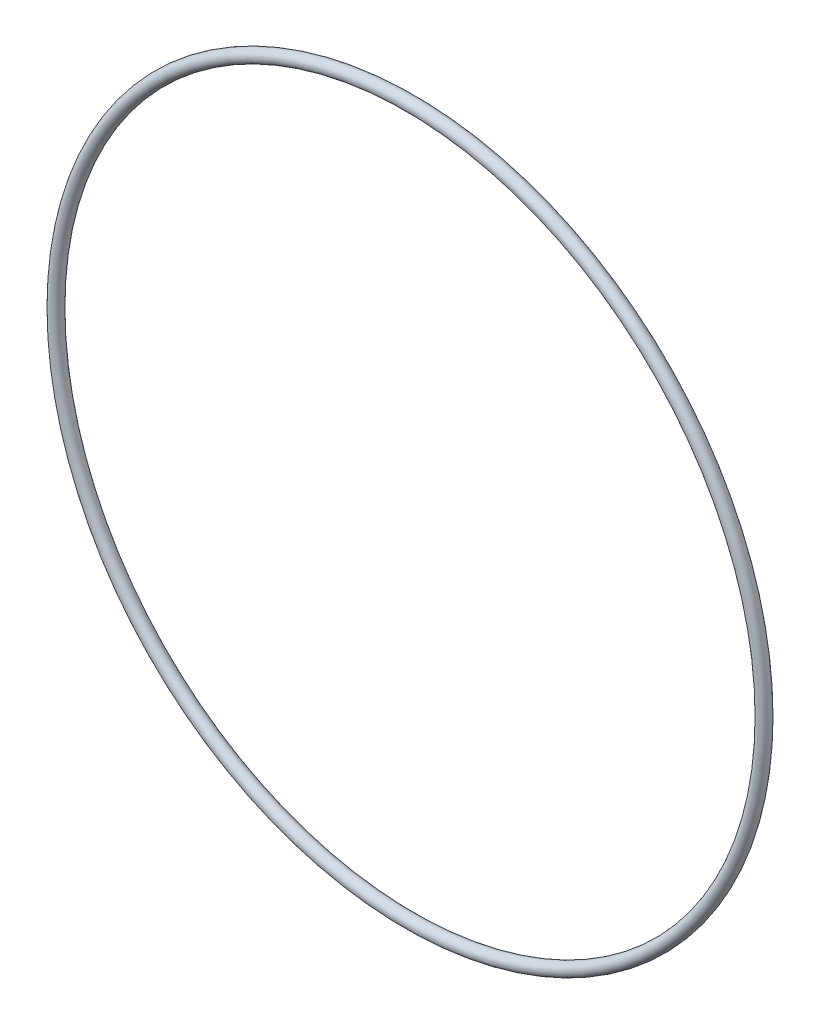
from build123d import *

# Parameters (mm, degrees)
SKETCH1_R = 1.5


with BuildPart() as part:
    # Sketch1 → Revolve1 (revolve)
    with BuildSketch(Plane.ZY):
        with Locations((0, 83.75)):
            Circle(SKETCH1_R)
    revolve(axis=Axis((0, 0, 0), (0, 0, -1)))


solid = part.part
